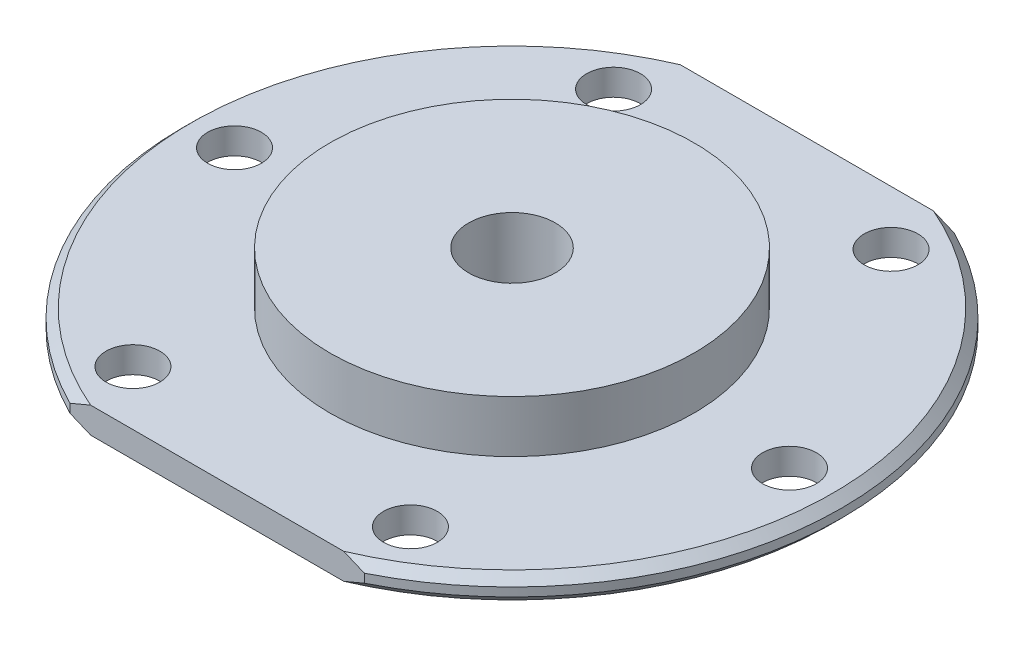
from build123d import *

# Parameters (mm, degrees)
SKETCH1_R           = 1.55
BOSS_EXTRUDE1_DEPTH = 1.5
SKETCH2_R           = 10.5
BOSS_EXTRUDE2_DEPTH = 3
SKETCH3_R           = 5
BOSS_EXTRUDE3_DEPTH = 5
SKETCH4_R           = 2.5
CUT_EXTRUDE1_DEPTH  = 28.207535721
CHAMFER1_SIZE       = 0.5


with BuildPart() as part:
    # Sketch1 → Boss-Extrude1 (new body)
    with BuildSketch(Plane(origin=(0, 0, 0), x_dir=(1, 0, 0), z_dir=(0, 1, 0))):
        with BuildLine():
            Line((-8.485281374, 17), (8.485281374, 17))
            ThreePointArc((8.485281374, 17), (19, 0), (8.485281374, -17))
            Line((8.485281374, -17), (-8.485281374, -17))
            ThreePointArc((-8.485281374, -17), (-19, 0), (-8.485281374, 17))
        make_face()
        with Locations(Location((-16, 0, 0), (0, 0, 270))):
            Circle(SKETCH1_R, mode=Mode.SUBTRACT)
        with Locations(Location((-8, 13.856406461, 0), (0, 0, 270))):
            Circle(SKETCH1_R, mode=Mode.SUBTRACT)
        with Locations(Location((8, 13.856406461, 0), (0, 0, 270))):
            Circle(SKETCH1_R, mode=Mode.SUBTRACT)
        with Locations(Location((16, 0, 0), (0, 0, 270))):
            Circle(SKETCH1_R, mode=Mode.SUBTRACT)
        with Locations(Location((8, -13.856406461, 0), (0, 0, 270))):
            Circle(SKETCH1_R, mode=Mode.SUBTRACT)
        with Locations(Location((-8, -13.856406461, 0), (0, 0, 270))):
            Circle(SKETCH1_R, mode=Mode.SUBTRACT)
    extrude(amount=BOSS_EXTRUDE1_DEPTH)

    # Sketch2 → Boss-Extrude2 (add)
    with BuildSketch(Plane(origin=(0, 1.5, 0), x_dir=(1, 0, 0), z_dir=(0, 1, 0))):
        with Locations(Location((0, 0, 0), (0, 0, 270))):
            Circle(SKETCH2_R)
    extrude(amount=BOSS_EXTRUDE2_DEPTH)

    # Sketch3 → Boss-Extrude3 (add)
    with BuildSketch(Plane.XZ):
        with Locations(Location((0, 0, 0), (0, 0, 270))):
            Circle(SKETCH3_R)
    extrude(amount=BOSS_EXTRUDE3_DEPTH)

    # Sketch4 → Cut-Extrude1 (cut, through all)
    with BuildSketch(Plane(origin=(0, 4.5, 0), x_dir=(1, 0, 0), z_dir=(0, 1, 0))):
        with Locations(Location((0, 0, 0), (0, 0, 270))):
            Circle(SKETCH4_R)
    extrude(amount=-CUT_EXTRUDE1_DEPTH, mode=Mode.SUBTRACT)

    # Chamfer1
    chamfer1_edges = [part.edges().sort_by_distance(p)[0] for p in [
        (-19, 1.5, 0),
        (0, -5, 5),
        (19, 1.5, 0),
        (0, -5, -2.5),
        (-19, 0, 0),
        (19, 0, 0),
    ]]
    chamfer(chamfer1_edges, length=CHAMFER1_SIZE)


solid = part.part
